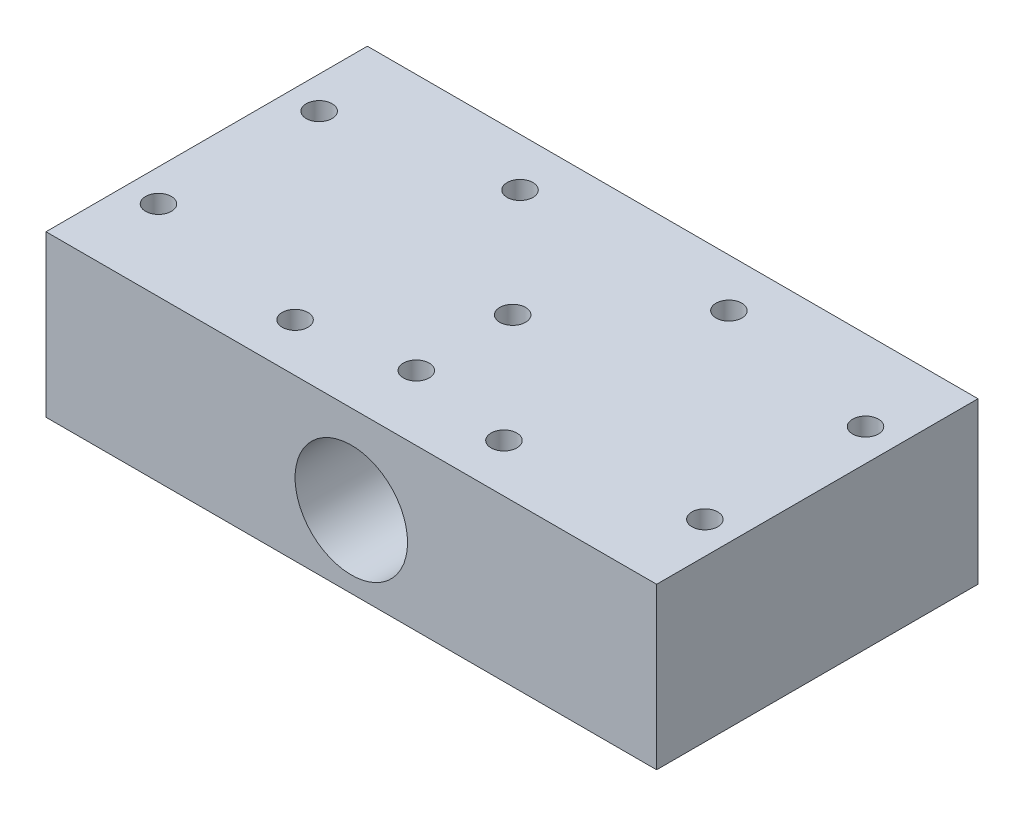
from build123d import *

# Parameters (mm, degrees)
SKETCH1_W                              = 63.5
SKETCH1_H                              = 31.75
BOSS_EXTRUDE1_DEPTH                    = 120.65
HOLE1_D                                = 22.225
TAPPED_HOLE_FOR_10_32_HELICOIL3_REACH  = 120.859
TAPPED_HOLE_FOR_10_32_HELICOIL3_BORE_R = 2.5527
TAPPED_HOLE_FOR_10_32_HELICOIL4_D      = 5.1054
TAPPED_HOLE_FOR_10_32_HELICOIL5_D      = 5.1054
TAPPED_HOLE_FOR_10_32_HELICOIL5_DEPTH  = 17.018
TAPPED_HOLE_FOR_10_32_HELICOIL5_TIP    = 1.533816902


with BuildPart() as part:
    # Sketch1 → Boss-Extrude1 (new body)
    with BuildSketch(Plane(origin=(0, 0, 0), x_dir=(0, 0, -1), z_dir=(1, 0, 0))):
        Rectangle(SKETCH1_W, SKETCH1_H)
    extrude(amount=-BOSS_EXTRUDE1_DEPTH)

    # Hole1 (through all)
    with Locations(Plane.XY.offset(31.75)):
        with Locations((-60.325, -1.5875)):
            Hole(HOLE1_D / 2)

    # Tapped Hole for #10-32 Helicoil3 bore → Tapped Hole for #10-32 Helicoil3 (cut, up to next)
    with BuildSketch(Plane(origin=(-13.662401891, 15.875, 9.153963567), x_dir=(1, 0, 0), z_dir=(0, 1, 0)), mode=Mode.PRIVATE) as tapped_hole_for_10_32_helicoil3_sk1:
        with Locations((-46.662598109, 9.289125094)):
            Circle(TAPPED_HOLE_FOR_10_32_HELICOIL3_BORE_R)
    tapped_hole_for_10_32_helicoil3_tool1 = extrude(tapped_hole_for_10_32_helicoil3_sk1.sketch, amount=-TAPPED_HOLE_FOR_10_32_HELICOIL3_REACH, mode=Mode.PRIVATE) & part.part
    # Tapped Hole for #10-32 Helicoil3 bore → Tapped Hole for #10-32 Helicoil3 (cut, up to next)
    with BuildSketch(Plane(origin=(-13.662401891, 15.875, 9.153963567), x_dir=(1, 0, 0), z_dir=(0, 1, 0)), mode=Mode.PRIVATE) as tapped_hole_for_10_32_helicoil3_sk2:
        with Locations((-46.662598109, -9.760874906)):
            Circle(TAPPED_HOLE_FOR_10_32_HELICOIL3_BORE_R)
    tapped_hole_for_10_32_helicoil3_tool2 = extrude(tapped_hole_for_10_32_helicoil3_sk2.sketch, amount=-TAPPED_HOLE_FOR_10_32_HELICOIL3_REACH, mode=Mode.PRIVATE) & part.part
    add(tapped_hole_for_10_32_helicoil3_tool1.solids().sort_by_distance((-60.325, 15.875, -0.135162))[0], mode=Mode.SUBTRACT)
    add(tapped_hole_for_10_32_helicoil3_tool2.solids().sort_by_distance((-60.325, 15.875, 18.914838))[0], mode=Mode.SUBTRACT)

    # Tapped Hole for #10-32 Helicoil4 (through all)
    with Locations(Plane(origin=(0, 15.875, 0), x_dir=(1, 0, 0), z_dir=(0, 1, 0))):
        with Locations((-114.3, 15.875), (-114.3, -15.875), (-6.35, -15.875), (-6.35, 15.875)):
            Hole(TAPPED_HOLE_FOR_10_32_HELICOIL4_D / 2)

    # Tapped Hole for #10-32 Helicoil5
    with Locations(Plane(origin=(0, 15.875, 0), x_dir=(1, 0, 0), z_dir=(0, 1, 0))):
        with Locations((-80.9625, 22.225), (-39.6875, -22.225), (-80.9625, -22.225), (-39.6875, 22.225)):
            Hole(TAPPED_HOLE_FOR_10_32_HELICOIL5_D / 2, depth=TAPPED_HOLE_FOR_10_32_HELICOIL5_DEPTH)
            with Locations((0, 0, -(TAPPED_HOLE_FOR_10_32_HELICOIL5_DEPTH + TAPPED_HOLE_FOR_10_32_HELICOIL5_TIP / 2))):  # 118° drill point
                Cone(0, TAPPED_HOLE_FOR_10_32_HELICOIL5_D / 2, TAPPED_HOLE_FOR_10_32_HELICOIL5_TIP, mode=Mode.SUBTRACT)


solid = part.part
